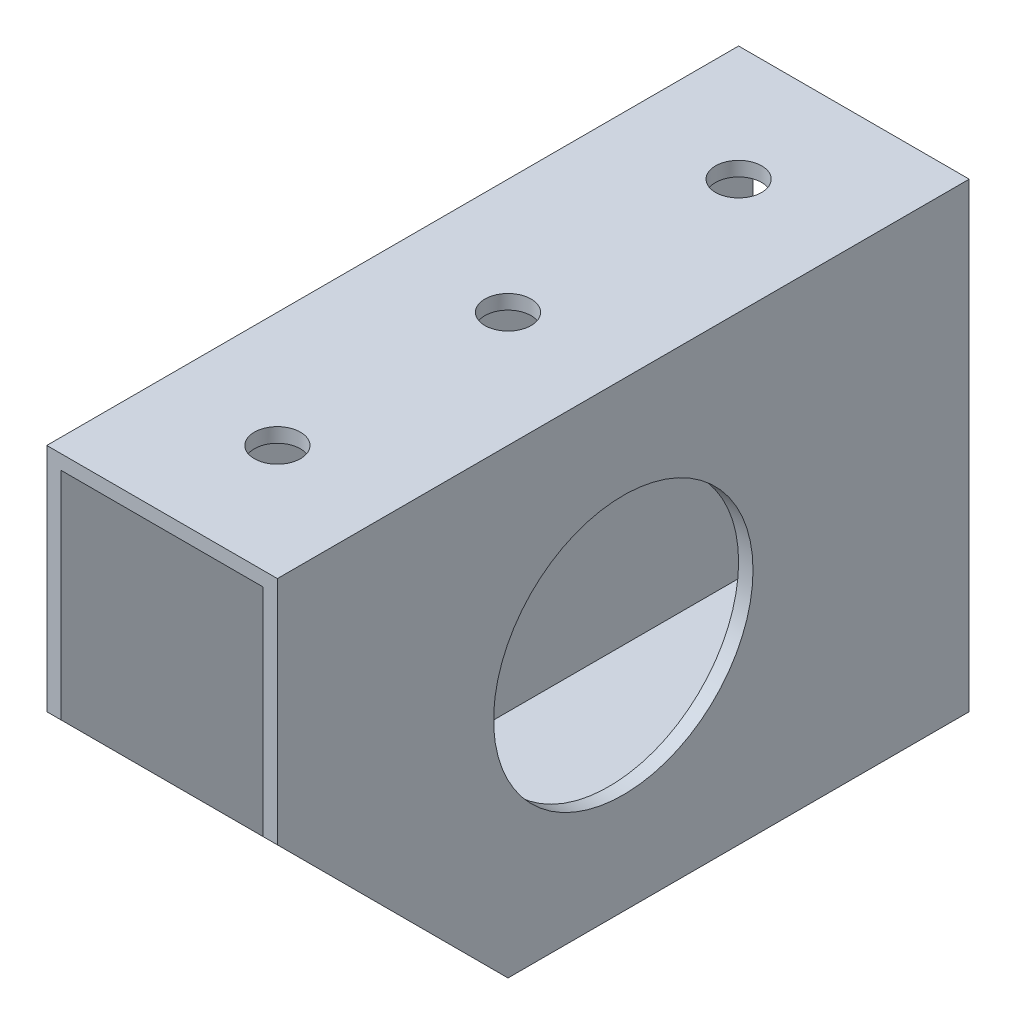
from build123d import *

# Parameters (mm, degrees)
SKETCH1_W           = 25.4
SKETCH1_H           = 50.8
SKETCH1_W_2         = 22.225
SKETCH1_H_2         = 47.625
BOSS_EXTRUDE1_DEPTH = 76.2
SKETCH2_R           = 14.2875
CUT_EXTRUDE1_DEPTH  = 96.038097624
CUT_EXTRUDE2_DEPTH  = 96.038097624
CUT_EXTRUDE3_REACH  = 97.038
SKETCH4_R           = 2.54
CUT_EXTRUDE4_REACH  = 97.038
SKETCH5_R           = 2.54


with BuildPart() as part:
    # Sketch1 → Boss-Extrude1 (new body)
    with BuildSketch(Plane.XY):
        with Locations((12.7, 25.4)):
            Rectangle(SKETCH1_W, SKETCH1_H)
        with Locations((12.7, 25.4)):
            Rectangle(SKETCH1_W_2, SKETCH1_H_2, mode=Mode.SUBTRACT)
    extrude(amount=BOSS_EXTRUDE1_DEPTH)

    # Sketch2 → Cut-Extrude1 (cut, through all)
    with BuildSketch(Plane(origin=(25.4, 0, 0), x_dir=(0, 0, -1), z_dir=(1, 0, 0))):
        with Locations((-38.1, 25.4)):
            Circle(SKETCH2_R)
    extrude(amount=-CUT_EXTRUDE1_DEPTH, mode=Mode.SUBTRACT)

    # Sketch3 → Cut-Extrude2 (cut, through all)
    with BuildSketch(Plane(origin=(25.4, 0, 0), x_dir=(0, 0, -1), z_dir=(1, 0, 0))):
        Polygon((-50.8, 0), (-76.2, 25.4), (-76.2, 0), align=None)
    extrude(amount=-CUT_EXTRUDE2_DEPTH, mode=Mode.SUBTRACT)

    # Sketch4 → Cut-Extrude3 (cut, up to next)
    with BuildSketch(Plane(origin=(0, 50.8, 0), x_dir=(1, 0, 0), z_dir=(0, 1, 0)), mode=Mode.PRIVATE) as cut_extrude3_sk1:
        with Locations(Location((12.7, -12.7, 0), (0, 0, 270))):
            Circle(SKETCH4_R)
    cut_extrude3_tool1 = extrude(cut_extrude3_sk1.sketch, amount=-CUT_EXTRUDE3_REACH, mode=Mode.PRIVATE) & part.part
    # Sketch4 → Cut-Extrude3 (cut, up to next)
    with BuildSketch(Plane(origin=(0, 50.8, 0), x_dir=(1, 0, 0), z_dir=(0, 1, 0)), mode=Mode.PRIVATE) as cut_extrude3_sk2:
        with Locations(Location((12.7, -38.1, 0), (0, 0, 270))):
            Circle(SKETCH4_R)
    cut_extrude3_tool2 = extrude(cut_extrude3_sk2.sketch, amount=-CUT_EXTRUDE3_REACH, mode=Mode.PRIVATE) & part.part
    # Sketch4 → Cut-Extrude3 (cut, up to next)
    with BuildSketch(Plane(origin=(0, 50.8, 0), x_dir=(1, 0, 0), z_dir=(0, 1, 0)), mode=Mode.PRIVATE) as cut_extrude3_sk3:
        with Locations(Location((12.7, -63.5, 0), (0, 0, 270))):
            Circle(SKETCH4_R)
    cut_extrude3_tool3 = extrude(cut_extrude3_sk3.sketch, amount=-CUT_EXTRUDE3_REACH, mode=Mode.PRIVATE) & part.part
    add(cut_extrude3_tool1.solids().sort_by_distance((12.7, 50.8, 12.7))[0], mode=Mode.SUBTRACT)
    add(cut_extrude3_tool2.solids().sort_by_distance((12.7, 50.8, 38.1))[0], mode=Mode.SUBTRACT)
    add(cut_extrude3_tool3.solids().sort_by_distance((12.7, 50.8, 63.5))[0], mode=Mode.SUBTRACT)

    # Sketch5 → Cut-Extrude4 (cut, up to next)
    with BuildSketch(Plane.XZ, mode=Mode.PRIVATE) as cut_extrude4_sk1:
        with Locations(Location((12.7, 12.7, 0), (0, 0, 90))):
            Circle(SKETCH5_R)
    cut_extrude4_tool1 = extrude(cut_extrude4_sk1.sketch, amount=-CUT_EXTRUDE4_REACH, mode=Mode.PRIVATE) & part.part
    # Sketch5 → Cut-Extrude4 (cut, up to next)
    with BuildSketch(Plane.XZ, mode=Mode.PRIVATE) as cut_extrude4_sk2:
        with Locations(Location((12.7, 39.6875, 0), (0, 0, 270))):
            Circle(SKETCH5_R)
    cut_extrude4_tool2 = extrude(cut_extrude4_sk2.sketch, amount=-CUT_EXTRUDE4_REACH, mode=Mode.PRIVATE) & part.part
    add(cut_extrude4_tool1.solids().sort_by_distance((12.7, 0, 12.7))[0], mode=Mode.SUBTRACT)
    add(cut_extrude4_tool2.solids().sort_by_distance((12.7, 0, 39.6875))[0], mode=Mode.SUBTRACT)


solid = part.part
